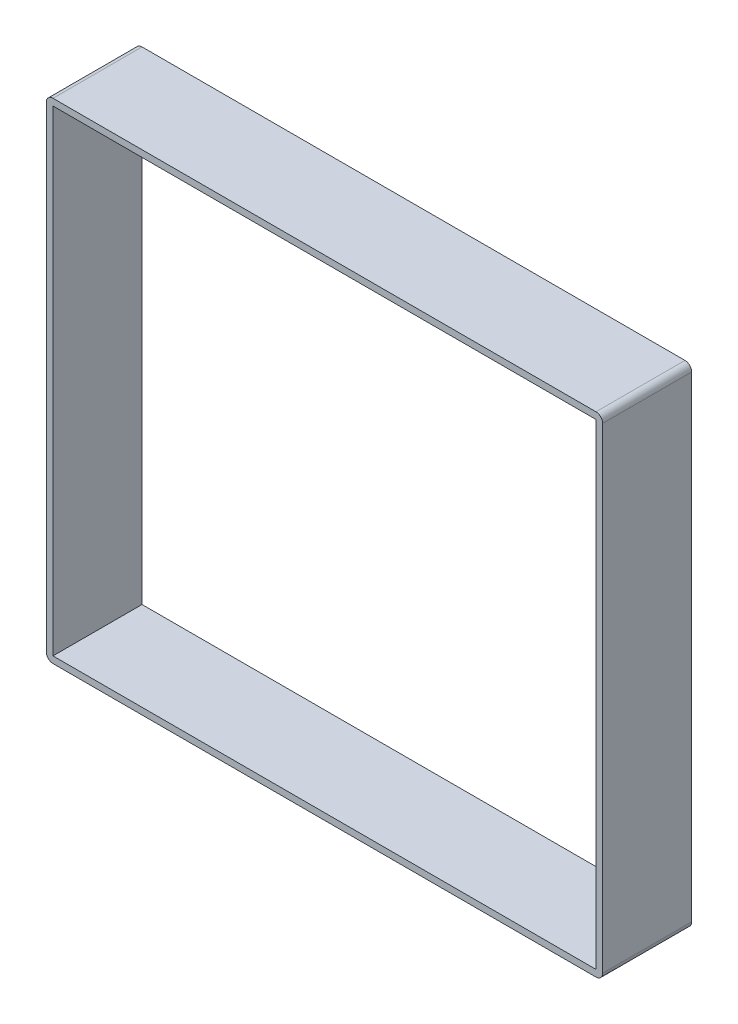
from build123d import *

# Parameters (mm, degrees)
SKETCH1_W           = 250
SKETCH1_H           = 220
SKETCH1_W_2         = 244
SKETCH1_H_2         = 214
EXTRUDE_THIN1_DEPTH = 40
FILLET1_R           = 3


with BuildPart() as part:
    # Sketch1 → Extrude-Thin1 (new body)
    with BuildSketch(Plane.XY):
        with Locations((35.461157826, 79.854863969)):
            Rectangle(SKETCH1_W, SKETCH1_H)
        with Locations((35.461157826, 79.854863969)):
            Rectangle(SKETCH1_W_2, SKETCH1_H_2, mode=Mode.SUBTRACT)
    extrude(amount=EXTRUDE_THIN1_DEPTH)

    # Fillet1
    fillet1_edges = [part.edges().sort_by_distance(p)[0] for p in [
        (160.461157826, -30.145136031, 20),
        (-89.538842174, -30.145136031, 20),
        (-89.538842174, 189.854863969, 20),
        (160.461157826, 189.854863969, 20),
    ]]
    fillet(fillet1_edges, radius=FILLET1_R)


solid = part.part
